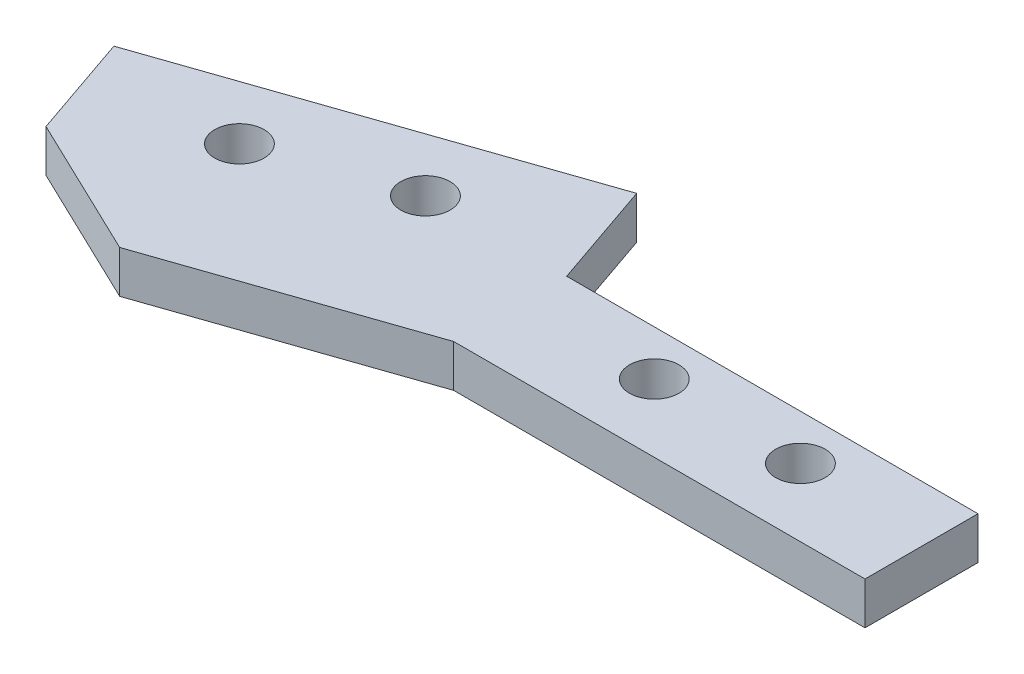
from build123d import *

# Parameters (mm, degrees)
SKETCH2_W           = 29.13019228
SKETCH2_H           = 8.0032651
BOSS_EXTRUDE1_DEPTH = 3
SKETCH3_R           = 1.75
CUT_EXTRUDE1_DEPTH  = 3
SKETCH5_W           = 29.13
SKETCH5_H           = 3
BOSS_EXTRUDE2_DEPTH = 8
SKETCH6_R           = 1.75
CUT_EXTRUDE3_DEPTH  = 7
CUT_EXTRUDE4_DEPTH  = 5
CUT_EXTRUDE5_DEPTH  = 3
CUT_EXTRUDE7_DEPTH  = 10


with BuildPart() as part:
    # Sketch2 → Boss-Extrude1 (new body)
    with BuildSketch(Plane(origin=(0, 0, 0), x_dir=(1, 0, 0), z_dir=(0, 1, 0))):
        Polygon((-50.225743969, 28.670443259), (-77.768700077, 19.18664292), (-77.768700077, 11.18337782), (-50.225743969, 20.667178159), align=None)
        with Locations((-35.660647829, 24.668810709)):
            Rectangle(SKETCH2_W, SKETCH2_H)
    extrude(amount=BOSS_EXTRUDE1_DEPTH)

    # Sketch3 → Cut-Extrude1 (cut)
    with BuildSketch(Plane.XZ):
        with Locations(Location((-30.470551689, -25.467178146, 0), (0, 0, 270))):
            Circle(SKETCH3_R)
        with Locations(Location((-40.820551689, -25.467178146, 0), (0, 0, 270))):
            Circle(SKETCH3_R)
    extrude(amount=-CUT_EXTRUDE1_DEPTH, mode=Mode.SUBTRACT)

    # Sketch5 → Boss-Extrude2 (add)
    with BuildSketch(Plane(origin=(-14.149302504, 0, -41.092558245), x_dir=(-0.9455185755993176, 0, 0.32556815445715426), z_dir=(-0.32556815445715426, 0, -0.9455185755993176))):
        with Locations((52.720190597, 1.5)):
            Rectangle(SKETCH5_W, SKETCH5_H)
    extrude(amount=BOSS_EXTRUDE2_DEPTH)

    # Sketch6 → Cut-Extrude3 (cut)
    with BuildSketch(Plane.XZ):
        with Locations(Location((-69.935655683, -25.201370089, 0), (0, 0, 270))):
            Circle(SKETCH6_R)
        with Locations(Location((-60.159815933, -28.600701946, 0), (0, 0, 270))):
            Circle(SKETCH6_R)
    extrude(amount=-CUT_EXTRUDE3_DEPTH, mode=Mode.SUBTRACT)

    # Sketch7 → Cut-Extrude4 (cut)
    with BuildSketch(Plane.XZ):
        Polygon((-77.768700077, -19.18664292), (-75.305049077, -12.031680889), (-77.768700077, -11.18337782), align=None)
    extrude(amount=-CUT_EXTRUDE4_DEPTH, mode=Mode.SUBTRACT)

    # Sketch9 → Cut-Extrude5 (cut)
    with BuildSketch(Plane.XZ):
        with BuildLine():
            Line((-75.305049077, -12.031680889), (-77.847985202, -19.416903645))
            add(Edge.make_bspline(
                [(-69.0352228, -14.190555206), (-74.086749011, -15.68616926), (-77.847985202, -19.416903645)],
                knots=[0, 0, 0, 1, 1, 1], degree=2))
            Line((-69.0352228, -14.190555206), (-75.305049077, -12.031680889))
        make_face()
    extrude(amount=-CUT_EXTRUDE5_DEPTH, mode=Mode.SUBTRACT)

    # Sketch10 → Cut-Extrude7 (cut)
    with BuildSketch(Plane.XZ):
        with BuildLine():
            Line((-75.305049077, -12.031680889), (-77.847985202, -19.416903645))
            add(Edge.make_bspline(
                [(-69.0352228, -14.190555206), (-74.086749011, -15.68616926), (-77.847985202, -19.416903645)],
                knots=[0, 0, 0, 1, 1, 1], degree=2))
            Line((-69.0352228, -14.190555206), (-75.305049077, -12.031680889))
        make_face()
        with BuildLine():
            add(Edge.make_bspline(
                [(-69.0352228, -14.190555206), (-74.086749011, -15.68616926), (-77.847985202, -19.416903645)],
                knots=[0, 0, 0, 1, 1, 1], degree=2))
            Line((-77.847985202, -19.416903645), (-67.8223159, -14.608192544))
            Line((-67.8223159, -14.608192544), (-69.0352228, -14.190555206))
        make_face()
    extrude(amount=-CUT_EXTRUDE7_DEPTH, mode=Mode.SUBTRACT)


solid = part.part
